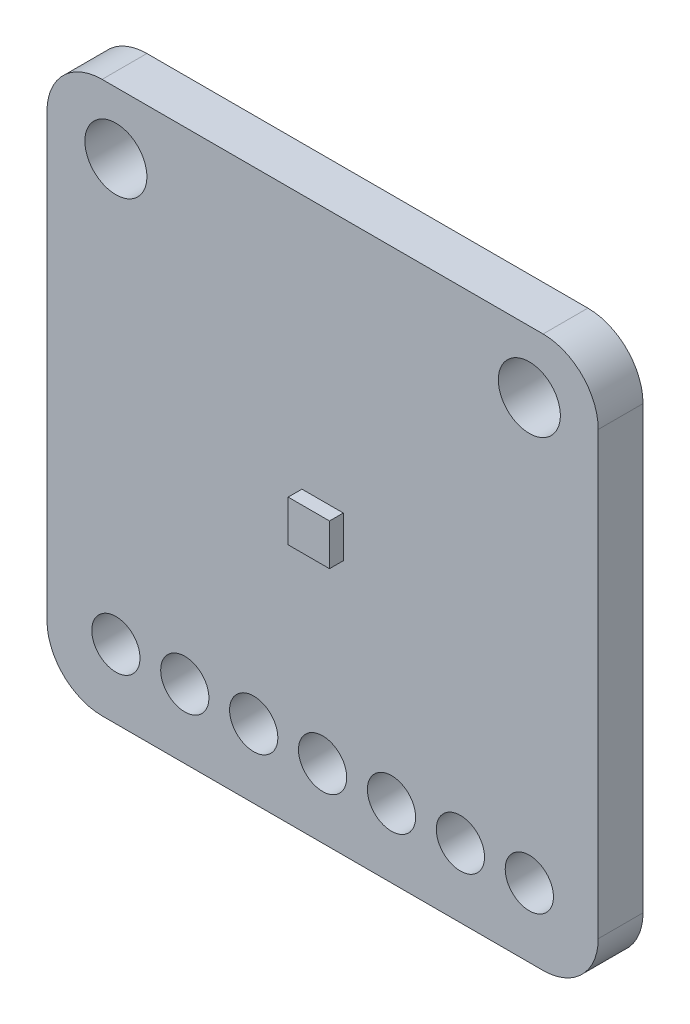
from build123d import *

# Parameters (mm, degrees)
SKETCH1_R           = 1.143
SKETCH1_R_2         = 0.889
BOSS_EXTRUDE1_DEPTH = 1.651
SKETCH2_W           = 1.524
SKETCH2_H           = 1.524
BOSS_EXTRUDE2_DEPTH = 0.508


with BuildPart() as part:
    # Sketch1 → Boss-Extrude1 (new body)
    with BuildSketch(Plane.XY):
        with BuildLine():
            Line((-8.057940151, 8.672775064), (8.198059849, 8.672775064))
            ThreePointArc((8.198059849, 8.672775064), (9.634900828, 8.077616044), (10.230059849, 6.640775064))
            Line((10.230059849, 6.640775064), (10.230059849, -9.615224936))
            ThreePointArc((10.230059849, -9.615224936), (9.634900828, -11.052065915), (8.198059849, -11.647224936))
            Line((8.198059849, -11.647224936), (-8.057940151, -11.647224936))
            ThreePointArc((-8.057940151, -11.647224936), (-9.49478113, -11.052065915), (-10.089940151, -9.615224936))
            Line((-10.089940151, -9.615224936), (-10.089940151, 6.640775064))
            ThreePointArc((-10.089940151, 6.640775064), (-9.49478113, 8.077616044), (-8.057940151, 8.672775064))
        make_face()
        with Locations(Location((-7.549940151, 6.386775064, 0), (0, 0, 180))):
            Circle(SKETCH1_R, mode=Mode.SUBTRACT)
        with Locations(Location((7.690059849, 6.386775064, 0), (0, 0, 180))):
            Circle(SKETCH1_R, mode=Mode.SUBTRACT)
        with Locations(Location((0.070059849, -9.107224936, 0), (0, 0, 180))):
            Circle(SKETCH1_R_2, mode=Mode.SUBTRACT)
        with Locations(Location((2.610059849, -9.107224936, 0), (0, 0, 180))):
            Circle(SKETCH1_R_2, mode=Mode.SUBTRACT)
        with Locations(Location((5.150059849, -9.107224936, 0), (0, 0, 180))):
            Circle(SKETCH1_R_2, mode=Mode.SUBTRACT)
        with Locations(Location((7.690059849, -9.107224936, 0), (0, 0, 180))):
            Circle(SKETCH1_R_2, mode=Mode.SUBTRACT)
        with Locations(Location((-2.469940151, -9.107224936, 0), (0, 0, 180))):
            Circle(SKETCH1_R_2, mode=Mode.SUBTRACT)
        with Locations(Location((-5.009940151, -9.107224936, 0), (0, 0, 180))):
            Circle(SKETCH1_R_2, mode=Mode.SUBTRACT)
        with Locations(Location((-7.549940151, -9.107224936, 0), (0, 0, 180))):
            Circle(SKETCH1_R_2, mode=Mode.SUBTRACT)
    extrude(amount=BOSS_EXTRUDE1_DEPTH)

    # Sketch2 → Boss-Extrude2 (add)
    with BuildSketch(Plane.XY.offset(1.651)):
        with Locations((0.070059849, -1.487224936)):
            Rectangle(SKETCH2_W, SKETCH2_H)
    extrude(amount=BOSS_EXTRUDE2_DEPTH)


solid = part.part
